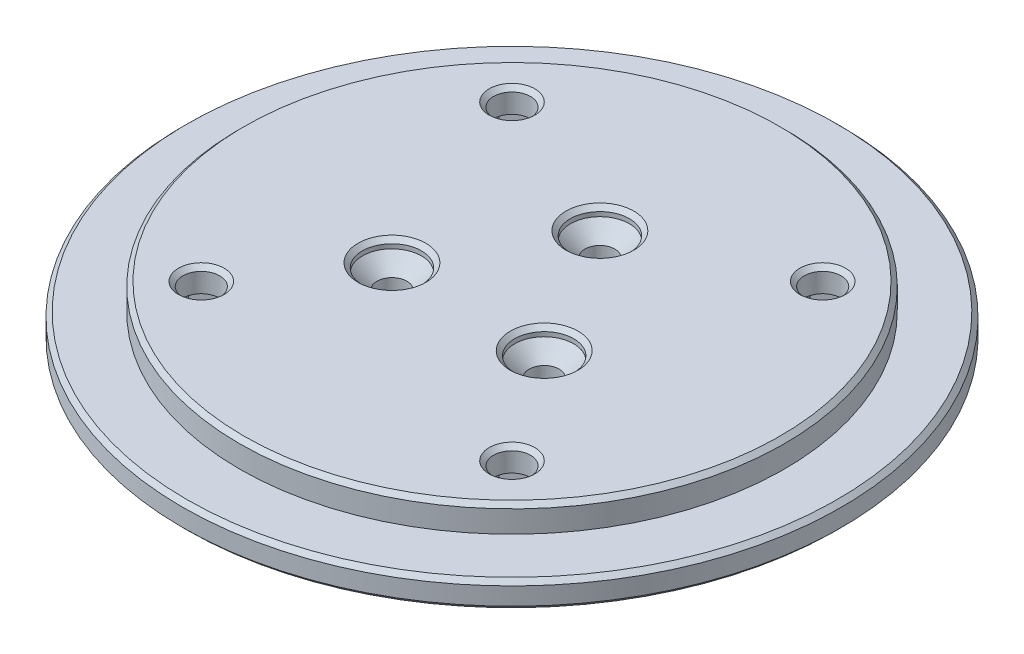
from build123d import *

# Parameters (mm, degrees)
SKETCH1_R                    = 37.5
BOSS_EXTRUDE1_DEPTH          = 6
CSK_FOR_M3_SFHCS1_AT_2_COUNT = 2
CSK_FOR_M3_SFHCS1_AT_2_PITCH = 17.32
CSK_FOR_M3_SFHCS1_AT_3_COUNT = 2
CSK_FOR_M3_SFHCS1_AT_3_PITCH = 17.32
SKETCH5_OUTSIDE_W            = 98.248
SKETCH5_OUTSIDE_H            = 98.248
SKETCH5_OUTSIDE_R            = 31
CUT_EXTRUDE2_DEPTH           = 3
F_4_0MM_DOWEL_HOLE1_D        = 4.2
F_4_0MM_DOWEL_HOLE1_DEPTH    = 10
F_4_0MM_DOWEL_HOLE1_TIP      = 1.2618073
CUT_EXTRUDE3_DEPTH           = 3.3
CHAMFER1_SIZE                = 0.5


with BuildPart() as part:
    # Sketch1 → Boss-Extrude1 (new body)
    with BuildSketch(Plane(origin=(0, 0, 0), x_dir=(1, 0, 0), z_dir=(0, 1, 0))):
        with Locations(Location((0, 0, 0), (0, 0, 270))):
            Circle(SKETCH1_R)
    extrude(amount=BOSS_EXTRUDE1_DEPTH)

    # Sketch3 → CSK for M3 SFHCS1 (revolve, cut)
    with BuildSketch(Plane(origin=(8.66, 6, 4.999853331), x_dir=(0, 0, 1), z_dir=(1, 0, 0))):
        Polygon((0, 0), (0, 11.021463052), (1.7, 10), (1.7, 2.66), (3.36, 1), (3.36, 0), align=None)
    csk_for_m3_sfhcs1 = revolve(axis=Axis((8.66, 12.35, 4.999853331), (0, -1, 0)), mode=Mode.SUBTRACT)

    # CSK for M3 SFHCS1 at 2: CSK for M3 SFHCS1 ×2
    with Locations(*[Vector(-0.5000000000000001, 0, -0.8660254037844387) * (i * CSK_FOR_M3_SFHCS1_AT_2_PITCH) for i in range(1, CSK_FOR_M3_SFHCS1_AT_2_COUNT)]):
        add(csk_for_m3_sfhcs1, mode=Mode.SUBTRACT)

    # CSK for M3 SFHCS1 at 3: CSK for M3 SFHCS1 ×2
    with Locations(*[(-i * CSK_FOR_M3_SFHCS1_AT_3_PITCH, 0, 0) for i in range(1, CSK_FOR_M3_SFHCS1_AT_3_COUNT)]):
        add(csk_for_m3_sfhcs1, mode=Mode.SUBTRACT)

    # Sketch5 outside → Cut-Extrude2 (cut)
    with BuildSketch(Plane(origin=(0, 6, 0), x_dir=(1, 0, 0), z_dir=(0, 1, 0))):
        Rectangle(SKETCH5_OUTSIDE_W, SKETCH5_OUTSIDE_H)
        with Locations(Location((0, 0, 0), (0, 0, 270))):
            Circle(SKETCH5_OUTSIDE_R, mode=Mode.SUBTRACT)
    extrude(amount=-CUT_EXTRUDE2_DEPTH, mode=Mode.SUBTRACT)

    # Ø4.0mm Dowel Hole1
    with Locations(Plane(origin=(0, 6, 0), x_dir=(1, 0, 0), z_dir=(0, 1, 0))):
        with Locations((17.67766953, 17.67766953), (-17.67766953, 17.67766953), (17.67766953, -17.67766953), (-17.67766953, -17.67766953)):
            Hole(F_4_0MM_DOWEL_HOLE1_D / 2, depth=F_4_0MM_DOWEL_HOLE1_DEPTH)
            with Locations((0, 0, -(F_4_0MM_DOWEL_HOLE1_DEPTH + F_4_0MM_DOWEL_HOLE1_TIP / 2))):  # 118° drill point
                Cone(0, F_4_0MM_DOWEL_HOLE1_D / 2, F_4_0MM_DOWEL_HOLE1_TIP, mode=Mode.SUBTRACT)

    # Sketch8 → Cut-Extrude3 (cut)
    with BuildSketch(Plane.XZ):
        Polygon((-14.22766953, 15.685811101), (-14.22766953, 19.669527958), (-17.67766953, 21.661386387), (-21.12766953, 19.669527958), (-21.12766953, 15.685811101), (-17.67766953, 13.693952672), align=None)
        Polygon((17.67766953, 13.693952672), (21.12766953, 15.685811101), (21.12766953, 19.669527958), (17.67766953, 21.661386387), (14.22766953, 19.669527958), (14.22766953, 15.685811101), align=None)
        Polygon((14.22766953, -19.669527958), (17.67766953, -21.661386387), (21.12766953, -19.669527958), (21.12766953, -15.685811101), (17.67766953, -13.693952672), (14.22766953, -15.685811101), align=None)
        Polygon((-14.22766953, -19.669527958), (-14.22766953, -15.685811101), (-17.67766953, -13.693952672), (-21.12766953, -15.685811101), (-21.12766953, -19.669527958), (-17.67766953, -21.661386387), align=None)
    extrude(amount=-CUT_EXTRUDE3_DEPTH, mode=Mode.SUBTRACT)

    # Chamfer1
    chamfer1_edges = [part.edges().sort_by_distance(p)[0] for p in [
        (15.95266953, 0, 14.689881887),
        (19.40266953, 0, 14.689881887),
        (21.12766953, 0, 17.67766953),
        (19.40266953, 0, 20.665457173),
        (15.95266953, 0, 20.665457173),
        (14.22766953, 0, 17.67766953),
        (-15.95266953, 0, 14.689881887),
        (-14.22766953, 0, 17.67766953),
        (-15.95266953, 0, 20.665457173),
        (-19.40266953, 0, 20.665457173),
        (-21.12766953, 0, 17.67766953),
        (-19.40266953, 0, 14.689881887),
        (-8.66, 0, 3.299853331),
        (-8.66, 6, 1.639853331),
        (0, 0, -37.5),
        (0, 0, -11.699706662),
        (0, 6, -13.359706662),
        (0, 3, -37.5),
        (0, 6, -31),
        (19.77766953, 6, -17.67766953),
        (-15.57766953, 6, 17.67766953),
        (19.77766953, 6, 17.67766953),
        (-15.57766953, 6, -17.67766953),
        (8.66, 0, 3.299853331),
        (8.66, 6, 1.639853331),
        (-15.95266953, 0, -20.665457173),
        (-14.22766953, 0, -17.67766953),
        (-15.95266953, 0, -14.689881887),
        (-19.40266953, 0, -14.689881887),
        (-21.12766953, 0, -17.67766953),
        (-19.40266953, 0, -20.665457173),
        (14.22766953, 0, -17.67766953),
        (15.95266953, 0, -20.665457173),
        (19.40266953, 0, -20.665457173),
        (21.12766953, 0, -17.67766953),
        (19.40266953, 0, -14.689881887),
        (15.95266953, 0, -14.689881887),
    ]]
    chamfer(chamfer1_edges, length=CHAMFER1_SIZE)


solid = part.part
